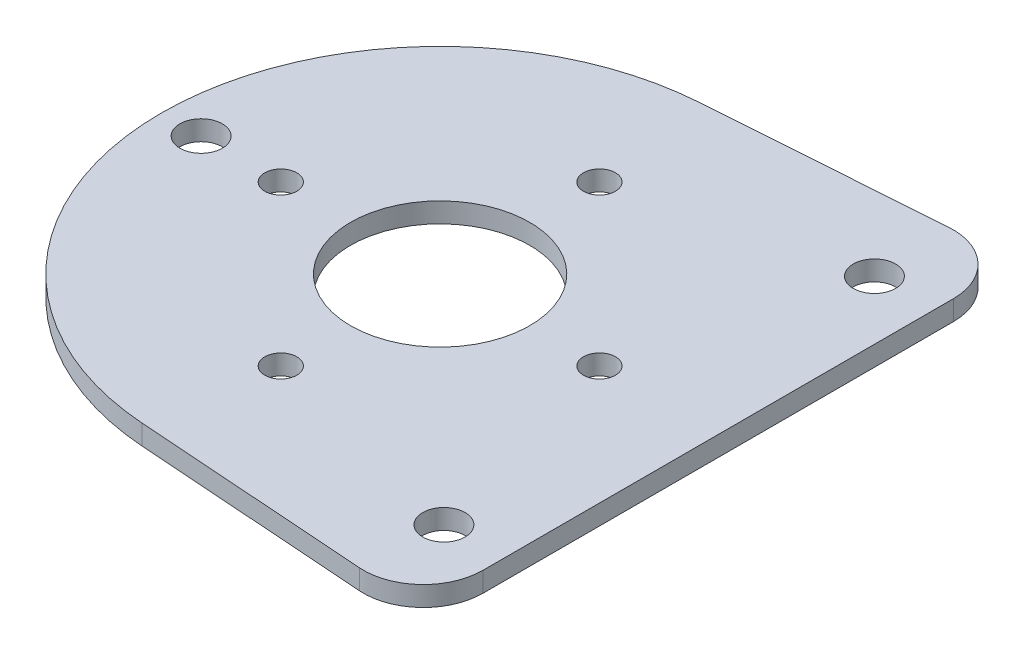
from build123d import *

# Parameters (mm, degrees)
SKETCH1_R               = 14.2875
SKETCH1_R_2             = 14.28115
BOSS_EXTRUDE1_DEPTH     = 3.175
F_10_CLEARANCE_HOLE1_D  = 5.1054
F_1_4_CLEARANCE_HOLE1_D = 6.7564
CUT_EXTRUDE2_DEPTH      = 150.23740385
FILLET2_R               = 9.525


with BuildPart() as part:
    # Sketch1 → Boss-Extrude1 (new body)
    with BuildSketch(Plane(origin=(0, 0, 0), x_dir=(1, 0, 0), z_dir=(0, 1, 0))):
        with BuildLine():
            Line((85.884602434, 50.671947857), (-3.15409287, 44.337954375))
            ThreePointArc((-3.15409287, 44.337954375), (-44.45, 0), (-3.15409287, -44.337954375))
            Line((-3.15409287, -44.337954375), (85.884602434, -50.671947857))
            ThreePointArc((85.884602434, -50.671947857), (140.28928, 0), (85.884602434, 50.671947857))
        make_face()
        with Locations(Location((89.48928, 0, 0), (0, 0, 270))):
            Circle(SKETCH1_R, mode=Mode.SUBTRACT)
        with Locations(Location((0, 0, 0), (0, 0, 270))):
            Circle(SKETCH1_R_2, mode=Mode.SUBTRACT)
    extrude(amount=BOSS_EXTRUDE1_DEPTH)

    # #10 Clearance Hole1 (through all)
    with Locations(Plane(origin=(0, 3.175, 0), x_dir=(1, 0, 0), z_dir=(0, 1, 0))):
        with Locations((0, 25.4), (25.4, 0), (0, -25.4), (-25.4, 0)):
            Hole(F_10_CLEARANCE_HOLE1_D / 2)

    # 1/4 Clearance Hole1 (through all)
    with Locations(Plane(origin=(0, 3.175, 0), x_dir=(1, 0, 0), z_dir=(0, 1, 0))):
        with Locations((54.56428, 34.925), (54.56428, -34.925), (114.88928, 25.4), (114.88928, -25.4), (-38.1, 0), (34.925, 34.314713318), (34.925, -34.314713318)):
            Hole(F_1_4_CLEARANCE_HOLE1_D / 2)

    # Sketch7 → Cut-Extrude2 (cut, through all)
    with BuildSketch(Plane(origin=(0, 3.175, 0), x_dir=(1, 0, 0), z_dir=(0, 1, 0))):
        Polygon((44.323, 47.715357826), (140.28928, 54.542162621), (140.28928, -54.542162621), (44.323, -47.715357826), align=None)
    extrude(amount=-CUT_EXTRUDE2_DEPTH, mode=Mode.SUBTRACT)

    # Fillet2
    fillet2_edges = [part.edges().sort_by_distance(p)[0] for p in [
        (44.323, 1.5875, -47.715357826),
        (44.323, 1.5875, 47.715357826),
    ]]
    fillet(fillet2_edges, radius=FILLET2_R)


solid = part.part
